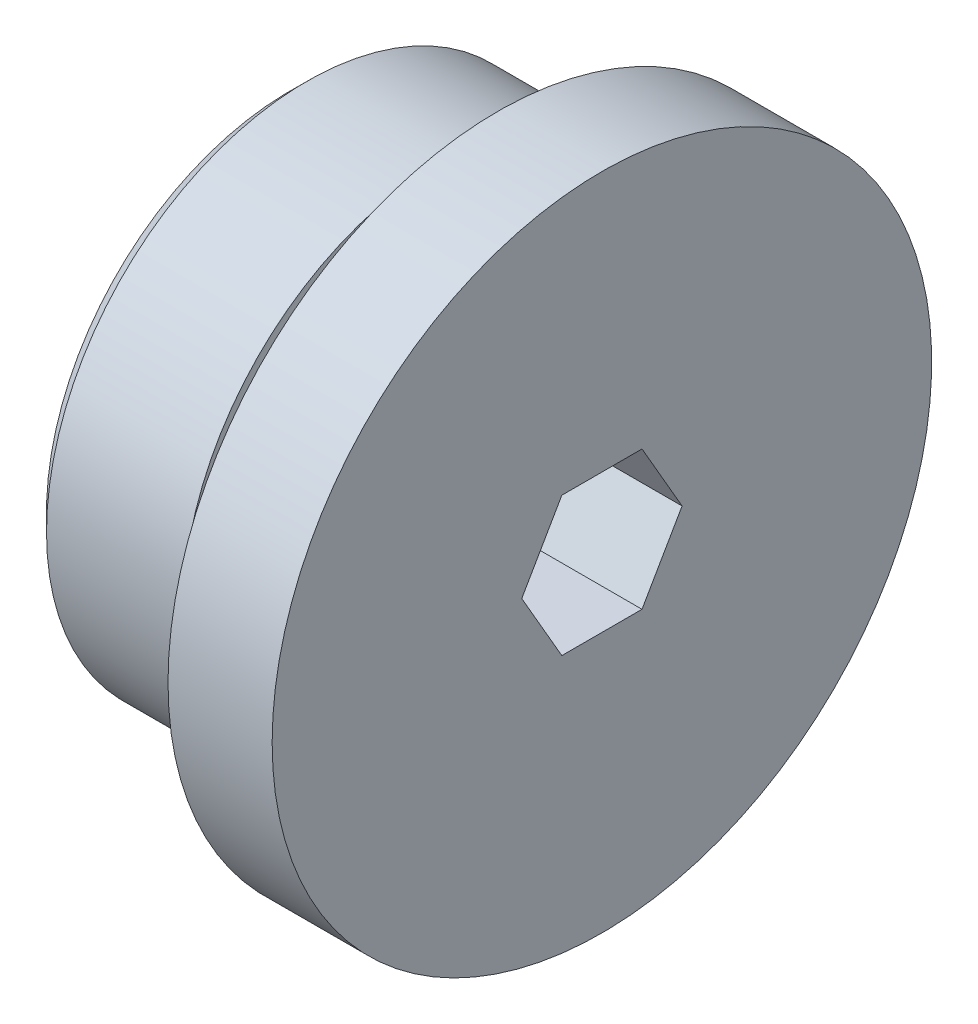
from build123d import *

# Parameters (mm, degrees)
ENL_V_MAT_EXTRU_1_DEPTH = 8
CHANFREIN1_SIZE         = 1


with BuildPart() as part:
    # Esquisse1 → Révolution1 (revolve)
    with BuildSketch(Plane.XY, mode=Mode.PRIVATE) as r_volution1_sk:
        with BuildLine():
            Line((0, 0), (0, 15))
            Line((0, 15), (8.860153684, 15))
            ThreePointArc((8.860153684, 15), (10.430076842, 13.430076842), (12, 15))
            Line((12, 15), (12, 19))
            Line((12, 19), (18, 19))
            Line((18, 19), (18, 0))
            Line((18, 0), (0, 0))
        make_face()
    revolve(r_volution1_sk.sketch.rotate(Axis((0, 0, 0), (1, 0, 0)), 90), axis=Axis((0, 0, 0), (1, 0, 0)))

    # Esquisse5 → Diamètre du perçage Ø8.0 (8)1 (revolve, cut)
    with BuildSketch(Plane(origin=(18, 0, 0), x_dir=(0, 0, -1), z_dir=(0, 1, 0))):
        Polygon((0, 0), (0, 12.403442476), (4, 10), (4, 0), align=None)
    revolve(axis=Axis((24.35, 0, 0), (-1, 0, 0)), mode=Mode.SUBTRACT)

    # Esquisse3 → Enlèv. mat.-Extru.1 (cut)
    with BuildSketch(Plane(origin=(18, 0, 0), x_dir=(0, 0, -1), z_dir=(1, 0, 0))):
        Polygon((-4.618802154, 0), (-2.309401077, 4), (2.309401077, 4), (4.618802154, 0), (2.309401077, -4), (-2.309401077, -4), align=None)
    extrude(amount=-ENL_V_MAT_EXTRU_1_DEPTH, mode=Mode.SUBTRACT)

    # Chanfrein1
    chanfrein1_edges = [part.edges().sort_by_distance(p)[0] for p in [
        (0, 0, -15),
    ]]
    chamfer(chanfrein1_edges, length=CHANFREIN1_SIZE)


solid = part.part
